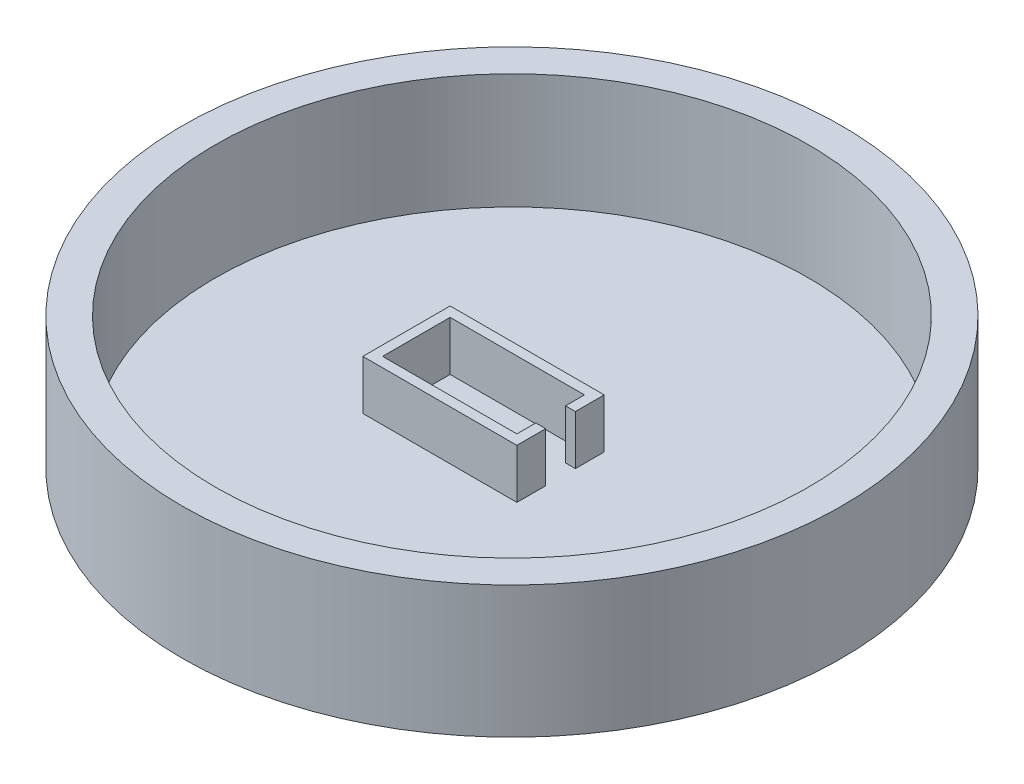
from build123d import *

# Parameters (mm, degrees)
SKETCH1_R           = 100
BOSS_EXTRUDE1_DEPTH = 40
SKETCH2_R           = 90
CUT_EXTRUDE1_DEPTH  = 35
SKETCH3_W           = 46.75
SKETCH3_H           = 26.5
BOSS_EXTRUDE2_DEPTH = 15
SKETCH4_W           = 3
SKETCH4_H           = 9
CUT_EXTRUDE2_DEPTH  = 15


with BuildPart() as part:
    # Sketch1 → Boss-Extrude1 (new body)
    with BuildSketch(Plane(origin=(0, 0, 0), x_dir=(1, 0, 0), z_dir=(0, 1, 0))):
        with Locations(Location((0, 0, 0), (0, 0, 270))):
            Circle(SKETCH1_R)
    extrude(amount=BOSS_EXTRUDE1_DEPTH)

    # Sketch2 → Cut-Extrude1 (cut)
    with BuildSketch(Plane(origin=(0, 40, 0), x_dir=(1, 0, 0), z_dir=(0, 1, 0))):
        with Locations(Location((0, 0, 0), (0, 0, 270))):
            Circle(SKETCH2_R)
    extrude(amount=-CUT_EXTRUDE1_DEPTH, mode=Mode.SUBTRACT)

    # Sketch3 → Boss-Extrude2 (add)
    with BuildSketch(Plane(origin=(0, 5, 0), x_dir=(1, 0, 0), z_dir=(0, 1, 0))):
        with Locations((-8.625, 0)):
            Rectangle(SKETCH3_W, SKETCH3_H)
        Polygon((0, 10.25), (11.75, 10.25), (11.75, -10.25), (0, -10.25), (-29, -10.25), (-29, 10.25), align=None, mode=Mode.SUBTRACT)
    extrude(amount=BOSS_EXTRUDE2_DEPTH)

    # Sketch4 → Cut-Extrude2 (cut)
    with BuildSketch(Plane(origin=(0, 20, 0), x_dir=(1, 0, 0), z_dir=(0, 1, 0))):
        with Locations((13.25, 0)):
            Rectangle(SKETCH4_W, SKETCH4_H)
    extrude(amount=-CUT_EXTRUDE2_DEPTH, mode=Mode.SUBTRACT)


solid = part.part
